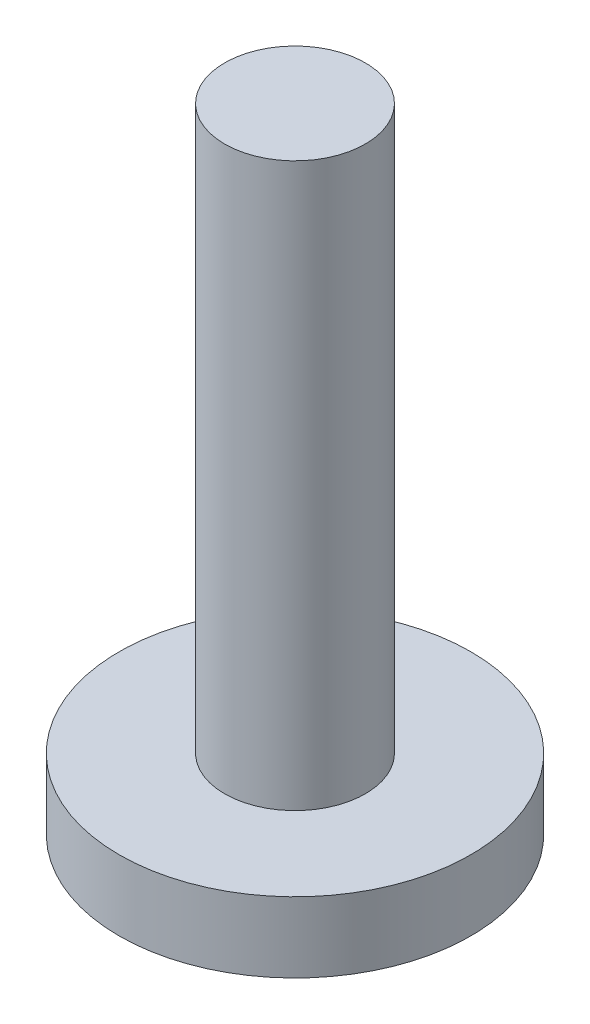
from build123d import *

# Parameters (mm, degrees)
SKETCH1_R           = 0.5
BOSS_EXTRUDE1_DEPTH = 4
SKETCH2_R           = 1.25
BOSS_EXTRUDE2_DEPTH = 0.5
CUT_EXTRUDE1_DEPTH  = 0.3


with BuildPart() as part:
    # Sketch1 → Boss-Extrude1 (new body)
    with BuildSketch(Plane(origin=(0, 0, 0), x_dir=(1, 0, 0), z_dir=(0, 1, 0))):
        with Locations(Location((0, 0, 0), (0, 0, 270))):
            Circle(SKETCH1_R)
    extrude(amount=BOSS_EXTRUDE1_DEPTH)

    # Sketch2 → Boss-Extrude2 (add)
    with BuildSketch(Plane.XZ):
        with Locations(Location((0, 0, 0), (0, 0, 270))):
            Circle(SKETCH2_R)
    extrude(amount=BOSS_EXTRUDE2_DEPTH)

    # Sketch3 → Cut-Extrude1 (cut)
    with BuildSketch(Plane.XZ.offset(0.5)):
        Polygon((-0.05, 0.85), (0.05, 0.85), (0.05, 0.05), (0.85, 0.05), (0.85, -0.05), (0.05, -0.05), (0.05, -0.85), (-0.05, -0.85), (-0.05, -0.05), (-0.85, -0.05), (-0.85, 0.05), (-0.05, 0.05), align=None)
    extrude(amount=-CUT_EXTRUDE1_DEPTH, mode=Mode.SUBTRACT)


solid = part.part
